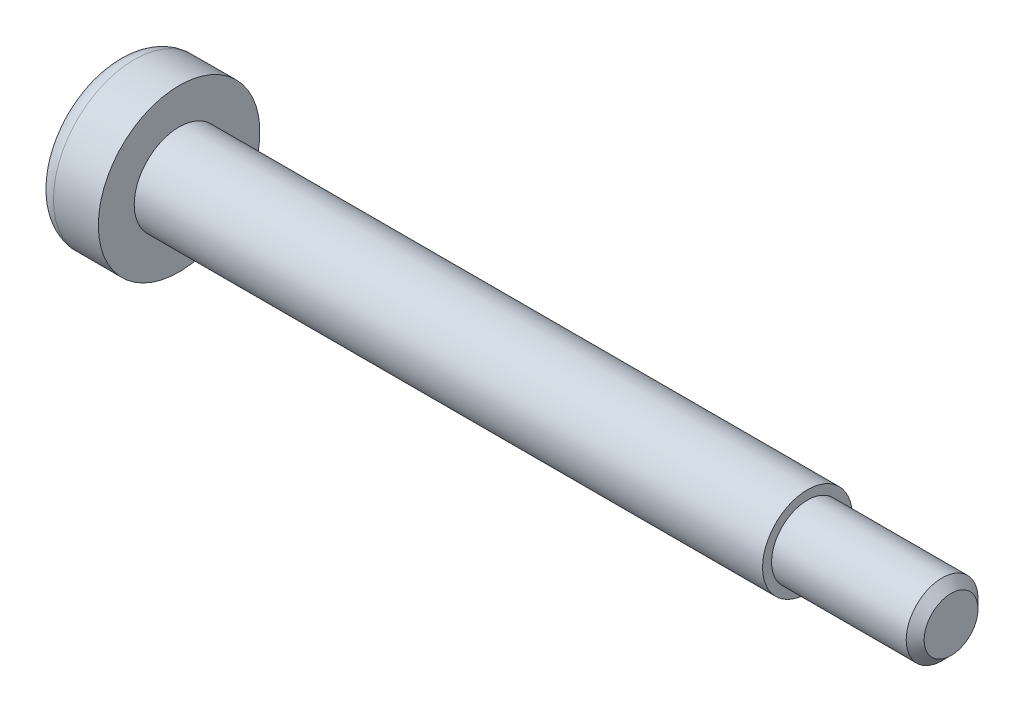
from build123d import *

# Parameters (mm, degrees)
CUT_EXTRUDE_1_DEPTH = 2.4
FILLET_1_R          = 1
CHAMFER_1_SIZE      = 0.5


with BuildPart() as part:
    # 草图1 → 旋转1 (revolve)
    with BuildSketch(Plane.XY, mode=Mode.PRIVATE) as revolve_1_sk:
        Polygon((0, 0), (0, 4.5), (3.5, 4.5), (3.5, 2.5), (38.5, 2.5), (38.5, 2), (46.5, 2), (46.5, 0), align=None)
    revolve(revolve_1_sk.sketch.rotate(Axis((0, 0, 0), (1, 0, 0)), 90), axis=Axis((0, 0, 0), (1, 0, 0)))

    # 草图2 → 切除-拉伸1 (cut)
    with BuildSketch(Plane.ZY):
        Polygon((0, 1.732050808), (-1.5, 0.866025404), (-1.5, -0.866025404), (0, -1.732050808), (1.5, -0.866025404), (1.5, 0.866025404), align=None)
    extrude(amount=-CUT_EXTRUDE_1_DEPTH, mode=Mode.SUBTRACT)

    # 圆角1
    fillet_1_edges = [part.edges().sort_by_distance(p)[0] for p in [
        (0, 0, -4.5),
    ]]
    fillet(fillet_1_edges, radius=FILLET_1_R)

    # 倒角1
    chamfer_1_edges = [part.edges().sort_by_distance(p)[0] for p in [
        (46.5, 0, -2),
    ]]
    chamfer(chamfer_1_edges, length=CHAMFER_1_SIZE)


solid = part.part
